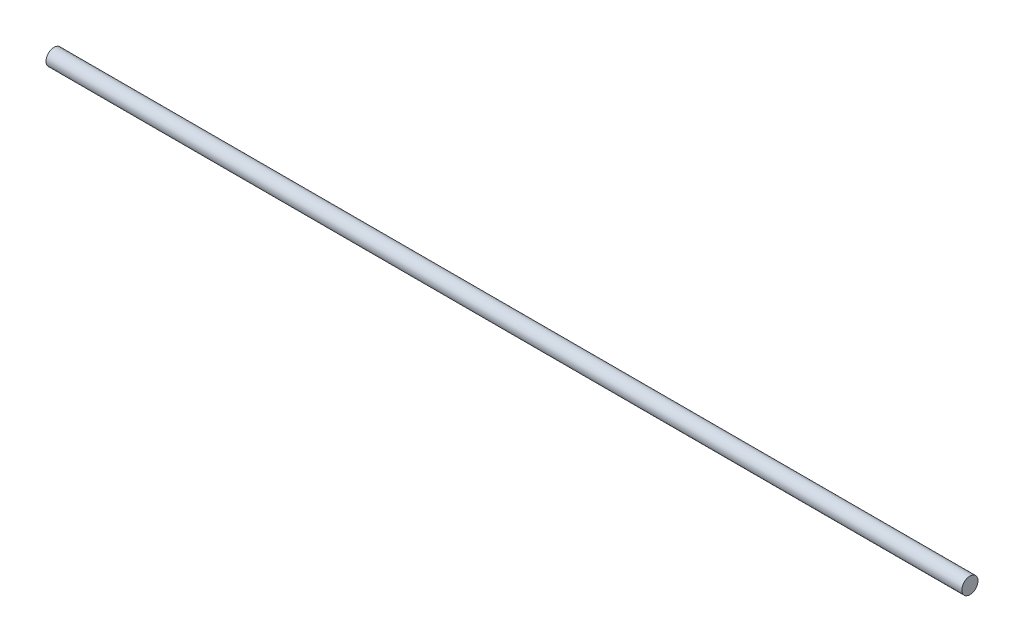
from build123d import *

# Parameters (mm, degrees)
SKETCH3_R           = 19.05
BOSS_EXTRUDE1_DEPTH = 2159


with BuildPart() as part:
    # Sketch3 → Boss-Extrude1 (new body)
    with BuildSketch(Plane(origin=(0, 0, 0), x_dir=(0, 0, -1), z_dir=(1, 0, 0))):
        Circle(SKETCH3_R)
    extrude(amount=BOSS_EXTRUDE1_DEPTH)


solid = part.part
